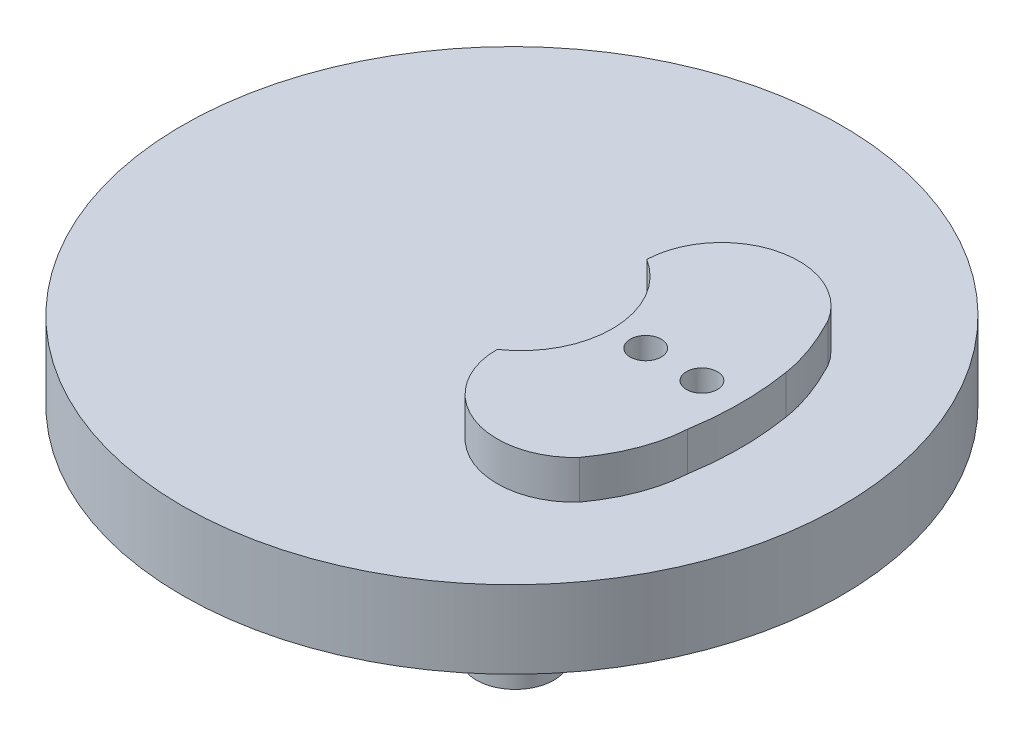
from build123d import *

# Parameters (mm, degrees)
SKETCH1_R               = 42.5
BOSS_EXTRUDE1_DEPTH     = 10
SKETCH2_R               = 5
BOSS_EXTRUDE2_DEPTH     = 7
SKETCH3_R               = 2
BOSS_EXTRUDE3_DEPTH     = 5
CUT_EXTRUDE1_DEPTH      = 63.461988577
CUT_EXTRUDE1_DEPTH_BACK = 63.461988577
SKETCH3_4_R             = 2


with BuildPart() as part:
    # Sketch1 → Boss-Extrude1 (new body)
    with BuildSketch(Plane(origin=(0, 0, 0), x_dir=(1, 0, 0), z_dir=(0, 1, 0))):
        Circle(SKETCH1_R)
    extrude(amount=BOSS_EXTRUDE1_DEPTH)

    # Sketch2 → Boss-Extrude2 (add)
    with BuildSketch(Plane.XZ):
        with Locations((-21.003335433, 21.421015399)):
            Circle(SKETCH2_R)
        with Locations((21.421015399, 21.003335433)):
            Circle(SKETCH2_R)
        with Locations((21.003335433, -21.421015399)):
            Circle(SKETCH2_R)
        with Locations((-21.421015399, -21.003335433)):
            Circle(SKETCH2_R)
    extrude(amount=BOSS_EXTRUDE2_DEPTH)

    # Sketch3 → Boss-Extrude3 (add)
    with BuildSketch(Plane(origin=(0, 10, 0), x_dir=(1, 0, 0), z_dir=(0, 1, 0))):
        with BuildLine():
            ThreePointArc((7.410610084, 9.984822024), (12.938182194, 0.241771609), (7.815144583, -9.719933589))
            ThreePointArc((7.815144583, -9.719933589), (14.183962111, -19.037364236), (25.178047354, -16.486591759))
            add(Edge.make_bspline(
                [(29, -6.35), (28.699050384, -11.600454078), (25.178047354, -16.486591759)],
                knots=[0.67268265, 0.67268265, 0.67268265, 1, 1, 1], degree=2))
            add(Edge.make_bspline(
                [(29, 6.35), (30.042272144, 0), (29, -6.35)],
                knots=[0, 0, 0, 1, 1, 1], degree=2))
            add(Edge.make_bspline(
                [(26.688052402, 13.325870914), (27.746594537, 11.107404767), (28.624649084, 8.772780294), (29, 6.35)],
                knots=[0.050650552, 0.050650552, 0.050650552, 0.050650552, 0.277553495, 0.277553495, 0.277553495, 0.277553495], degree=3))
            add(Edge.make_bspline(
                [(25.95577439, 14.793850517), (26.206471304, 14.310519768), (26.451758672, 13.821089407), (26.688052402, 13.325870914)],
                knots=[0, 0, 0, 0, 0.050650552, 0.050650552, 0.050650552, 0.050650552], degree=3))
            ThreePointArc((25.95577439, 14.793850517), (14.893502945, 19.290955178), (7.410610084, 9.984822024))
        make_face()
        with Locations((24.5, 0)):
            Circle(SKETCH3_R, mode=Mode.SUBTRACT)
        with Locations((17.25, 0)):
            Circle(SKETCH3_R, mode=Mode.SUBTRACT)
    extrude(amount=BOSS_EXTRUDE3_DEPTH)

    # Sketch3<4> → Cut-Extrude1 (cut, two sides: drawn at the far end of the back side and taken through both)
    with BuildSketch(Plane(origin=(0, 10, 0), x_dir=(1, 0, 0), z_dir=(0, 1, 0)).offset(-CUT_EXTRUDE1_DEPTH_BACK)):
        with Locations((17.25, 0)):
            Circle(SKETCH3_4_R)
        with Locations((24.5, 0)):
            Circle(SKETCH3_4_R)
    extrude(amount=CUT_EXTRUDE1_DEPTH + CUT_EXTRUDE1_DEPTH_BACK, mode=Mode.SUBTRACT)


solid = part.part
